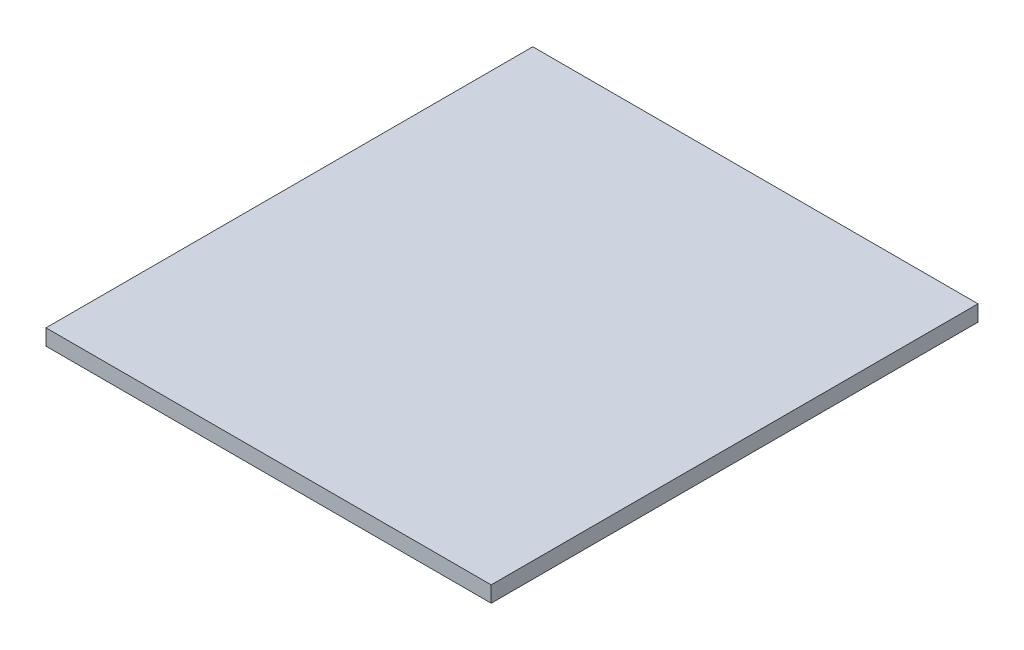
from build123d import *

# Parameters (mm, degrees)
SKETCH1_W           = 503
SKETCH1_H           = 550
BOSS_EXTRUDE1_DEPTH = 18


with BuildPart() as part:
    # Sketch1 → Boss-Extrude1 (new body)
    with BuildSketch(Plane(origin=(0, 0, 0), x_dir=(1, 0, 0), z_dir=(0, 1, 0))):
        Rectangle(SKETCH1_W, SKETCH1_H)
    extrude(amount=BOSS_EXTRUDE1_DEPTH)


solid = part.part
